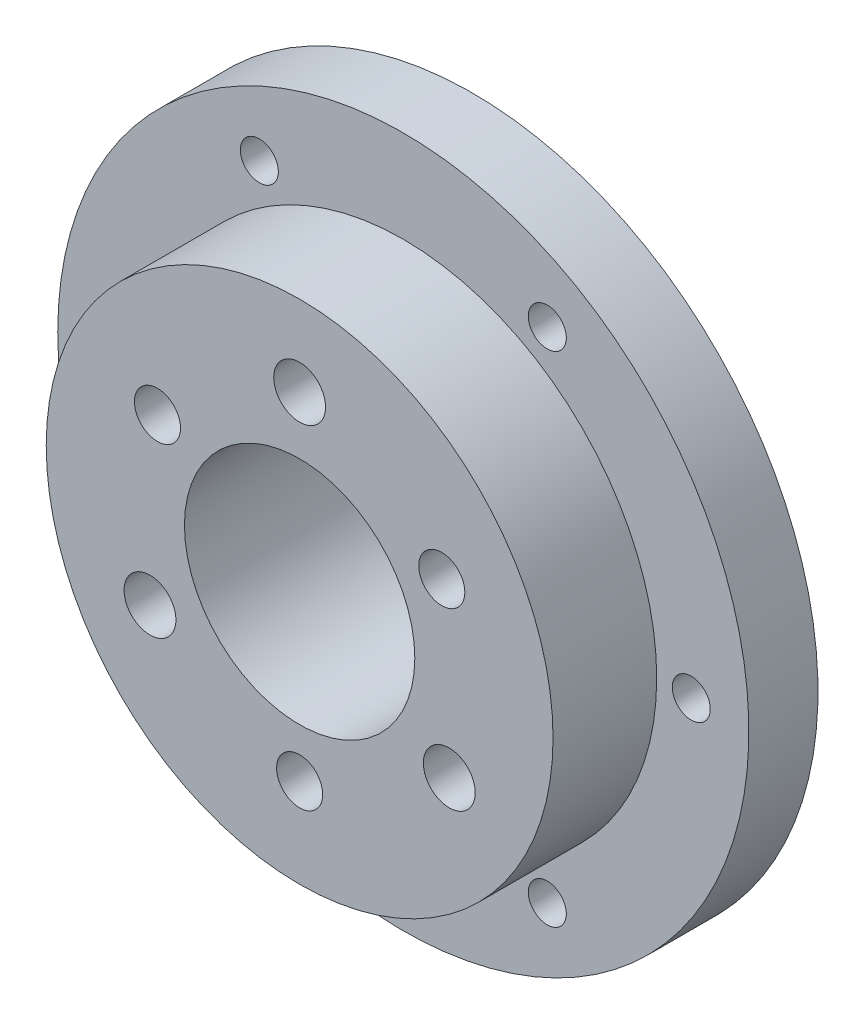
from build123d import *

# Parameters (mm, degrees)
SKETCH_1_R                = 22
EXTRUDE_1_DEPTH           = 15
SKETCH_6_R                = 30
EXTRUDE_2_DEPTH           = 6
CUT_EXTRUDE_1_DEPTH       = 46
CUT_EXTRUDE_1_DEPTH_BACK  = 46
SKETCH_2_R                = 2
SKETCH_3_R                = 10
CUT_EXTRUDE_2_DEPTH       = 46
HOLE_WIZARD_1_D           = 4.5
HOLE_WIZARD_1_CBORE_D     = 8
HOLE_WIZARD_1_CBORE_DEPTH = 4.6
HOLE_WIZARD_M4_1_D        = 3.3


with BuildPart() as part:
    # 草图1 → 凸台-拉伸1 (new body)
    with BuildSketch(Plane.XY):
        Circle(SKETCH_1_R)
    extrude(amount=EXTRUDE_1_DEPTH)

    # 草图6 → 凸台-拉伸2 (add)
    with BuildSketch(Plane(origin=(0, 0, 0), x_dir=(-1, 0, 0), z_dir=(0, 0, -1))):
        Circle(SKETCH_6_R)
    extrude(amount=-EXTRUDE_2_DEPTH)

    # 草图2 → 切除-拉伸1 (cut, two sides: drawn at the far end of the back side and taken through both)
    with BuildSketch(Plane.XY.offset(15).offset(-CUT_EXTRUDE_1_DEPTH_BACK)):
        with Locations((-12.340862004, 7.125)):
            Circle(SKETCH_2_R)
        with Locations((12.340862004, 7.125)):
            Circle(SKETCH_2_R)
        with Locations((0, -14.25)):
            Circle(SKETCH_2_R)
    extrude(amount=CUT_EXTRUDE_1_DEPTH + CUT_EXTRUDE_1_DEPTH_BACK, mode=Mode.SUBTRACT)

    # 草图3 → 切除-拉伸2 (cut, through all)
    with BuildSketch(Plane(origin=(0, 0, 0), x_dir=(-1, 0, 0), z_dir=(0, 0, -1))):
        Circle(SKETCH_3_R)
    extrude(amount=-CUT_EXTRUDE_2_DEPTH, mode=Mode.SUBTRACT)

    # 打孔尺寸(%根据)内六角圆柱头螺钉的类型1 (through all)
    with Locations(Plane(origin=(12.990381057, -7.5, 0), x_dir=(-1, 0, 0), z_dir=(0, 0, -1))):
        with Locations((0, 0), (25.980762114, 0), (12.990381057, 22.5)):
            CounterBoreHole(HOLE_WIZARD_1_D / 2, HOLE_WIZARD_1_CBORE_D / 2, HOLE_WIZARD_1_CBORE_DEPTH)

    # M4 螺纹孔1 (through all)
    with Locations(Plane(origin=(25, 0, 0), x_dir=(-1, 0, 0), z_dir=(0, 0, -1))):
        with Locations((0, 0), (12.5, 21.650635095), (37.5, 21.650635095), (50, 0), (37.5, -21.650635095), (12.5, -21.650635095)):
            Hole(HOLE_WIZARD_M4_1_D / 2)


solid = part.part
